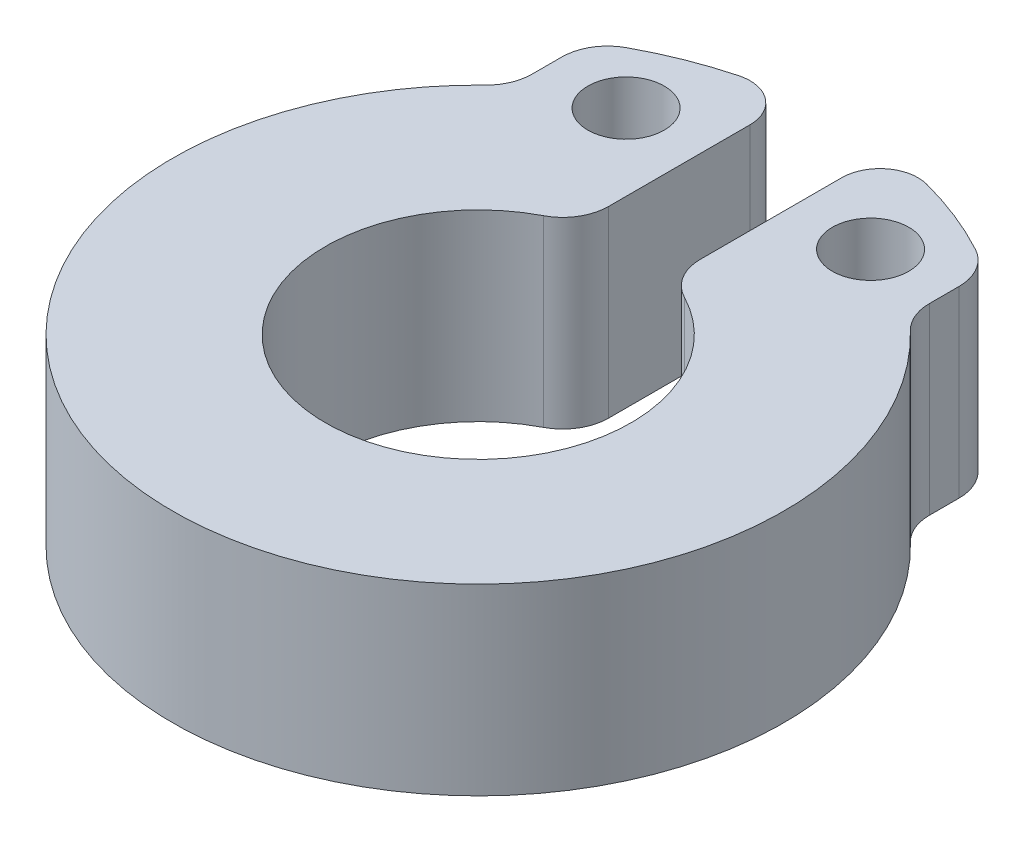
from build123d import *

# Parameters (mm, degrees)
SKETCH1_R           = 0.25
BOSS_EXTRUDE1_DEPTH = 1.2
FILLET1_R           = 0.3
FILLET2_R           = 0.25


with BuildPart() as part:
    # Sketch1 → Boss-Extrude1 (new body)
    with BuildSketch(Plane(origin=(0, 0, 0), x_dir=(1, 0, 0), z_dir=(0, 1, 0))):
        with BuildLine():
            Line((-0.3, 0.953939201), (-0.3, 2.38117618))
            ThreePointArc((-0.3, 2.38117618), (-0.820413855, 2.255420383), (-1.3, 2.0174241))
            Line((-1.3, 2.0174241), (-1.3, 1.519868415))
            ThreePointArc((-1.3, 1.519868415), (0, -2), (1.3, 1.519868415))
            Line((1.3, 1.519868415), (1.3, 2.0174241))
            ThreePointArc((1.3, 2.0174241), (0.820413855, 2.255420383), (0.3, 2.38117618))
            Line((0.3, 2.38117618), (0.3, 0.953939201))
            ThreePointArc((0.3, 0.953939201), (0, -1), (-0.3, 0.953939201))
        make_face()
        with Locations(Location((-0.8, 1.7674241, 0), (0, 0, 270))):
            Circle(SKETCH1_R, mode=Mode.SUBTRACT)
        with Locations(Location((0.8, 1.7674241, 0), (0, 0, 270))):
            Circle(SKETCH1_R, mode=Mode.SUBTRACT)
    extrude(amount=BOSS_EXTRUDE1_DEPTH)

    # Fillet1
    fillet1_edges = [part.edges().sort_by_distance(p)[0] for p in [
        (0.3, 0.6, -0.953939201),
        (1.3, 0.6, -2.0174241),
        (1.3, 0.6, -1.519868415),
        (-1.3, 0.6, -1.519868415),
        (-1.3, 0.6, -2.0174241),
        (-0.3, 0.6, -0.953939201),
    ]]
    fillet(fillet1_edges, radius=FILLET1_R)

    # Fillet2
    fillet2_edges = [part.edges().sort_by_distance(p)[0] for p in [
        (0.3, 0.6, -2.38117618),
        (-0.3, 0.6, -2.38117618),
    ]]
    fillet(fillet2_edges, radius=FILLET2_R)


solid = part.part
